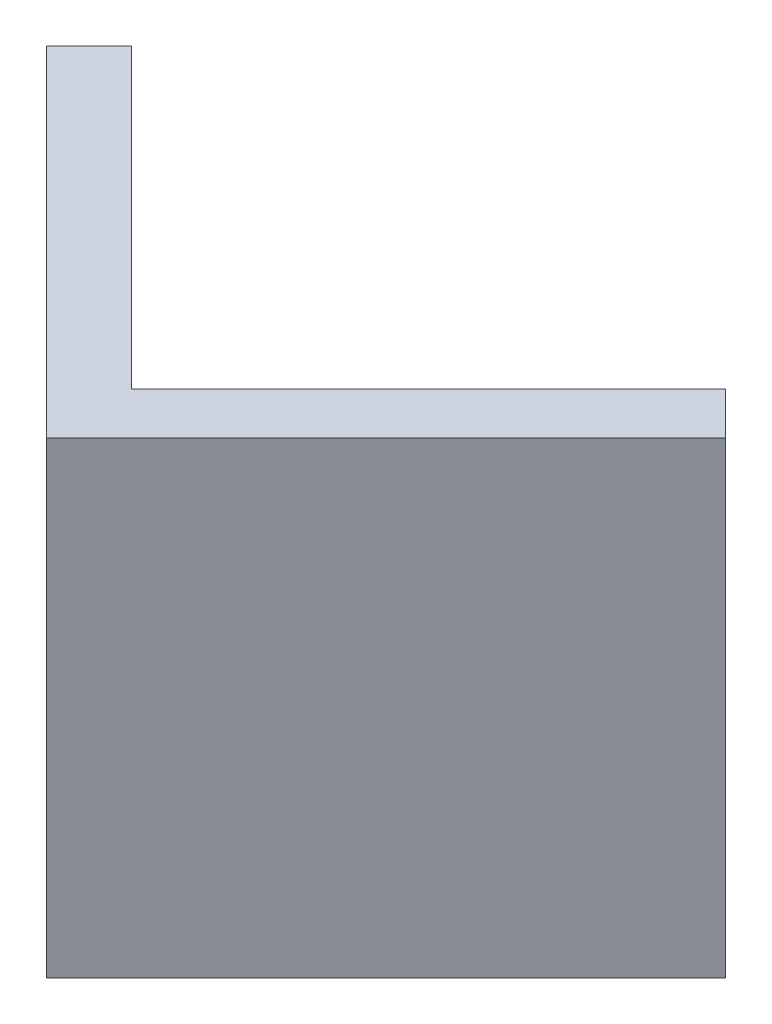
from build123d import *

# Parameters (mm, degrees)
SALIENTE_EXTRUIR1_DEPTH = 4
SALIENTE_EXTRUIR2_DEPTH = 35


with BuildPart() as part:
    # Croquis1 → Saliente-Extruir1 (new body)
    with BuildSketch(Plane(origin=(0, 0, 0), x_dir=(1, 0, 0), z_dir=(0, 1, 0))):
        Polygon((8.284271247, 28.284271247), (36.568542495, 0), (8.284271247, -28.284271247), (-20, 0), align=None)
    extrude(amount=SALIENTE_EXTRUIR1_DEPTH)

    # Croquis2 → Saliente-Extruir2 (add)
    with BuildSketch(Plane(origin=(0, 4, 0), x_dir=(1, 0, 0), z_dir=(0, 1, 0))):
        Polygon((-20, 0), (-16.464466094, 3.535533906), (8.284271247, -21.213203436), (33.033008589, 3.535533906), (36.568542495, 0), (8.284271247, -28.284271247), align=None)
    extrude(amount=SALIENTE_EXTRUIR2_DEPTH)


solid = part.part
